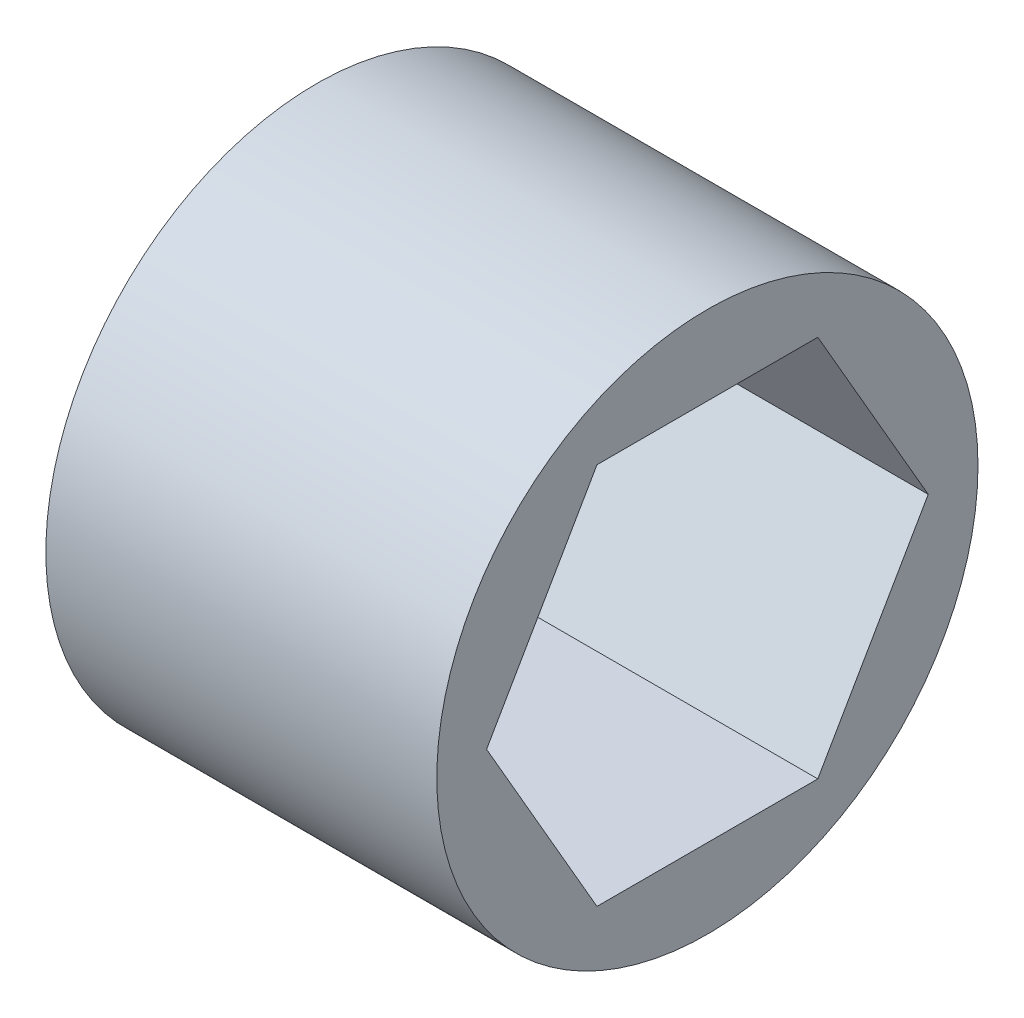
from build123d import *

# Parameters (mm, degrees)
SKETCH1_R           = 9.525
BOSS_EXTRUDE1_DEPTH = 13.76045


with BuildPart() as part:
    # Sketch1 → Boss-Extrude1 (new body)
    with BuildSketch(Plane(origin=(0, 0, 0), x_dir=(0, 0, -1), z_dir=(1, 0, 0))):
        Circle(SKETCH1_R)
        Polygon((7.772289324, 0), (3.886144662, 6.731), (-3.886144662, 6.731), (-7.772289324, 0), (-3.886144662, -6.731), (3.886144662, -6.731), align=None, mode=Mode.SUBTRACT)
    extrude(amount=BOSS_EXTRUDE1_DEPTH)


solid = part.part
